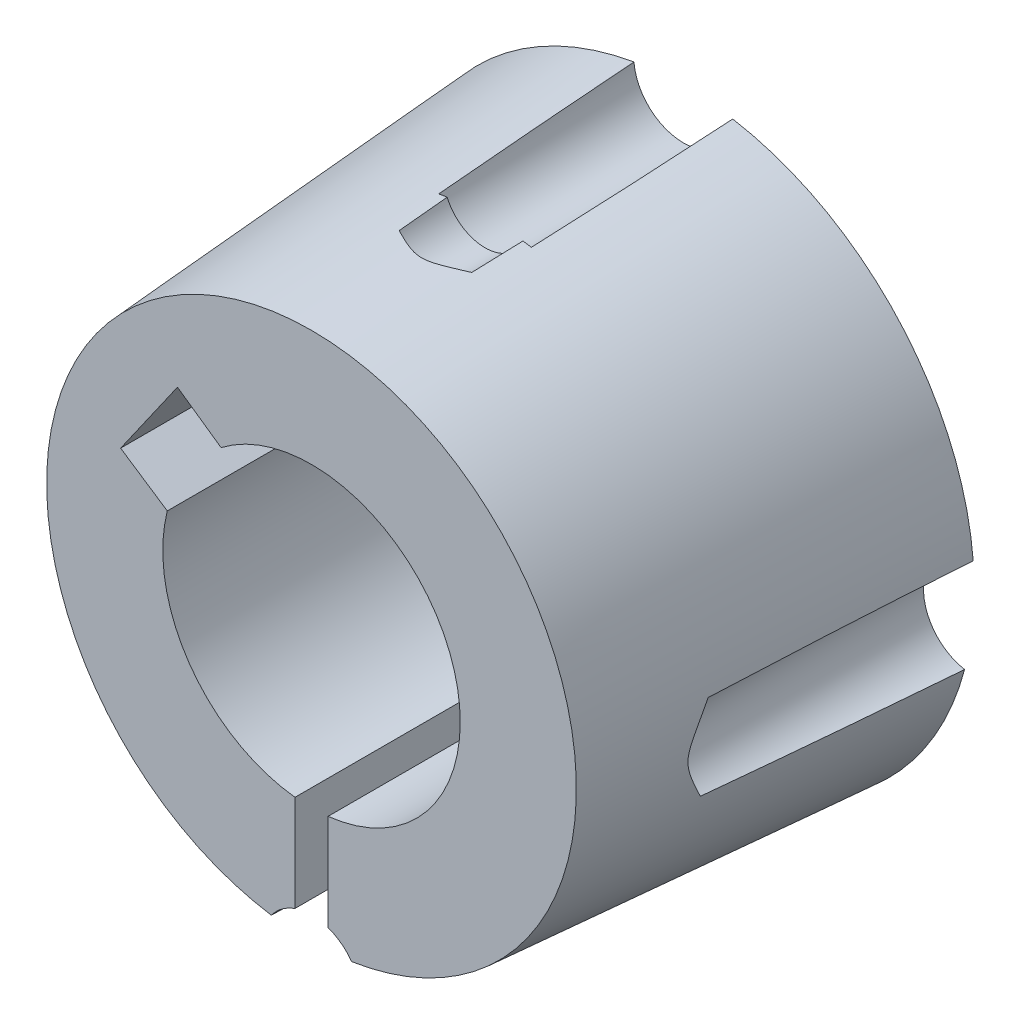
from build123d import *

# Parameters (mm, degrees)
SKETCH1_R                       = 50
EXTRUDE1_DEPTH                  = 22.5
F_6_0_6_DIAMETER_HOLE2_D        = 6
F_6_0_6_DIAMETER_HOLE2_DEPTH    = 15
F_6_0_6_DIAMETER_HOLE2_TIP      = 1.802581857
SKETCH4_R                       = 50
SKETCH4_R_2                     = 17.6
CUT_EXTRUDE1_DEPTH              = 75.204110398
CUT_EXTRUDE1_DRAFT              = 4
SKETCH6_R                       = 9
CUT_EXTRUDE2_DEPTH              = 34.520451954
SKETCH11_W                      = 2
SKETCH11_H                      = 100
CUT_EXTRUDE3_DEPTH              = 34.520451954
SKETCH12_R                      = 3
CUT_EXTRUDE4_DEPTH              = 34.520451954
M6X1_0_TAPPED_HOLE2_D           = 5
M6X1_0_TAPPED_HOLE2_DEPTH       = 15
M6X1_0_TAPPED_HOLE2_CBORE_D     = 6
M6X1_0_TAPPED_HOLE2_CBORE_DEPTH = 12
M6X1_0_TAPPED_HOLE2_TIP         = 1.502151548
CUT_EXTRUDE5_DEPTH              = 34.386914688
CUT_EXTRUDE6_DEPTH              = 0.5


with BuildPart() as part:
    # Sketch1 → Extrude1 (new body)
    with BuildSketch(Plane.XY):
        with Locations(Location((0, 0, 0), (0, 0, 180))):
            Circle(SKETCH1_R)
    extrude(amount=EXTRUDE1_DEPTH)

    # Ø6.0 (6) Diameter Hole2
    with Locations(Plane(origin=(17.533026686, -1.533941072, 0), x_dir=(-1, 0, 0), z_dir=(0, 0, -1))):
        with Locations((0, 0), (35.066053372, 0)):
            Hole(F_6_0_6_DIAMETER_HOLE2_D / 2, depth=F_6_0_6_DIAMETER_HOLE2_DEPTH)
            with Locations((0, 0, -(F_6_0_6_DIAMETER_HOLE2_DEPTH + F_6_0_6_DIAMETER_HOLE2_TIP / 2))):  # 118° drill point
                Cone(0, F_6_0_6_DIAMETER_HOLE2_D / 2, F_6_0_6_DIAMETER_HOLE2_TIP, mode=Mode.SUBTRACT)


with BuildPart() as cut_extrude1_tool:
    # Sketch4 → Cut-Extrude1 (with draft: the straight prism first)
    with BuildSketch(Plane(origin=(0, 0, 0), x_dir=(-1, 0, 0), z_dir=(0, 0, -1))):
        Circle(SKETCH4_R)
        Circle(SKETCH4_R_2, mode=Mode.SUBTRACT)
    extrude(amount=-CUT_EXTRUDE1_DEPTH)
    # Cut-Extrude1: the draft: its side faces are tilted about the plane it starts from
    cut_extrude1_sides = [cut_extrude1_tool.faces().sort_by_distance(p)[0] for p in [
        (50, 0, 37.602055199),
        (17.6, 0, 37.602055199),
    ]]
    draft(cut_extrude1_sides, Plane(origin=(0, 0, 0), x_dir=(-1, 0, 0), z_dir=(0, 0, -1)), CUT_EXTRUDE1_DRAFT)


with BuildPart() as part_1:
    add(part.part)

    # Cut-Extrude1: cut by cut_extrude1_tool
    add(cut_extrude1_tool.part, mode=Mode.SUBTRACT)

    # Sketch6 → Cut-Extrude2 (cut, through all)
    with BuildSketch(Plane(origin=(0, 0, 0), x_dir=(-1, 0, 0), z_dir=(0, 0, -1))):
        Circle(SKETCH6_R)
    extrude(amount=-CUT_EXTRUDE2_DEPTH, mode=Mode.SUBTRACT)

    # Sketch11 → Cut-Extrude3 (cut, through all)
    with BuildSketch(Plane(origin=(0, 0, 0), x_dir=(-1, 0, 0), z_dir=(0, 0, -1))):
        with Locations((0, -54)):
            Rectangle(SKETCH11_W, SKETCH11_H)
    extrude(amount=-CUT_EXTRUDE3_DEPTH, mode=Mode.SUBTRACT)

    # Sketch12 → Cut-Extrude4 (cut, through all)
    with BuildSketch(Plane.XY):
        with Locations((0, -17.6)):
            Circle(SKETCH12_R)
    extrude(amount=CUT_EXTRUDE4_DEPTH, mode=Mode.SUBTRACT)

    # M6x1.0 Tapped Hole2
    with Locations(Plane(origin=(0, 0, 0), x_dir=(-1, 0, 0), z_dir=(0, 0, -1))):
        with Locations((0, 17.6)):
            CounterBoreHole(M6X1_0_TAPPED_HOLE2_D / 2, M6X1_0_TAPPED_HOLE2_CBORE_D / 2, M6X1_0_TAPPED_HOLE2_CBORE_DEPTH, depth=M6X1_0_TAPPED_HOLE2_DEPTH)
            with Locations((0, 0, -(M6X1_0_TAPPED_HOLE2_DEPTH + M6X1_0_TAPPED_HOLE2_TIP / 2))):  # 118° drill point
                Cone(0, M6X1_0_TAPPED_HOLE2_D / 2, M6X1_0_TAPPED_HOLE2_TIP, mode=Mode.SUBTRACT)

    # Sketch18 → Cut-Extrude5 (cut, through all)
    with BuildSketch(Plane(origin=(0, 0, 0), x_dir=(-1, 0, 0), z_dir=(0, 0, -1))):
        Polygon((8.11084141, 8.990863372), (11.550562357, 4.074734834), (2.554311965, -1.904488745), (-0.736786804, 2.795687402), align=None)
    extrude(amount=-CUT_EXTRUDE5_DEPTH, mode=Mode.SUBTRACT)

    # Sketch19 → Cut-Extrude6 (cut)
    # profile 1 of 10: a face of its own
    with BuildSketch(Plane(origin=(0, 0, 0), x_dir=(-1, 0, 0), z_dir=(0, 0, -1))):
        Polygon((-6.01507707, 13.968245292), (-5.743815551, 14.076686297), (-5.398457979, 13.212974358), (-5.177441853, 13.819099158), (-4.837490431, 13.954888921), (-5.09507757, 13.250181389), (-4.348392875, 12.896237579), (-4.685482218, 12.761401842), (-5.343442454, 13.075912559), (-5.144368937, 12.577910756), (-5.415630455, 12.469469751), align=None)
    # profile 2 of 10: a face of its own
    with BuildSketch(Plane(origin=(0, 0, 0), x_dir=(-1, 0, 0), z_dir=(0, 0, -1))):
        with BuildLine():
            Line((-6.078039909, 13.192163481), (-6.233864227, 12.9619251))
            add(Edge.make_bspline(
                [(-6.233864227, 12.9619251), (-6.248946143, 12.966848248), (-6.27784851, 12.976282769), (-6.320838057, 12.985793765), (-6.361278198, 12.989885031), (-6.399724181, 12.989856015), (-6.437177789, 12.984442746), (-6.474869085, 12.974574494), (-6.513853227, 12.961181151), (-6.539172828, 12.948651003), (-6.55219105, 12.942208553)],
                knots=[0, 0, 0, 0, 1.154782209, 2.212977454, 3.198323303, 4.109115155, 5.005269035, 5.945001516, 6.943410408, 8, 8, 8, 8], degree=3))
            add(Edge.make_bspline(
                [(-6.55219105, 12.942208553), (-6.563958672, 12.935819324), (-6.586944135, 12.923339368), (-6.618924133, 12.901917763), (-6.647710423, 12.878657357), (-6.673338853, 12.853455393), (-6.695681333, 12.826183535), (-6.715223043, 12.797353546), (-6.731139602, 12.766401177), (-6.744213656, 12.734194299), (-6.753619605, 12.700899561), (-6.759891402, 12.667267843), (-6.762003912, 12.63354707), (-6.760712484, 12.599668346), (-6.755952611, 12.565777113), (-6.747559619, 12.53168274), (-6.735479808, 12.497602131), (-6.724865718, 12.475493483), (-6.719463687, 12.464241306)],
                knots=[0, 0, 0, 0, 1.129656753, 2.206536146, 3.243275769, 4.249138173, 5.23425726, 6.214366924, 7.182728485, 8.166221291, 9.143181902, 10.097808322, 11.048191284, 11.98824369, 12.954867981, 13.931295931, 14.947134859, 16, 16, 16, 16], degree=3))
            add(Edge.make_bspline(
                [(-6.719463687, 12.464241306), (-6.713609421, 12.453528046), (-6.702196679, 12.432642819), (-6.682167815, 12.40368607), (-6.660378201, 12.377553033), (-6.636320239, 12.354623223), (-6.610701465, 12.334270991), (-6.582982975, 12.317034089), (-6.553080028, 12.303113916), (-6.521746047, 12.291636982), (-6.489269067, 12.283304252), (-6.45607558, 12.279008547), (-6.422618026, 12.277482811), (-6.388759248, 12.280328486), (-6.354559846, 12.285974388), (-6.319944238, 12.295335099), (-6.285087612, 12.308362781), (-6.262297722, 12.319363983), (-6.250718695, 12.324953445)],
                knots=[0, 0, 0, 0, 1.065470632, 2.077107925, 3.069116516, 4.03148788, 4.974068206, 5.921906282, 6.874253604, 7.849361619, 8.832694848, 9.794888128, 10.767532634, 11.751519169, 12.755888645, 13.791011223, 14.877662763, 16, 16, 16, 16], degree=3))
            add(Edge.make_bspline(
                [(-6.250718695, 12.324953445), (-6.236773353, 12.332525923), (-6.209508406, 12.347331097), (-6.172202851, 12.373680364), (-6.138832908, 12.402124287), (-6.110418646, 12.433669667), (-6.085935614, 12.467265969), (-6.065805454, 12.503422115), (-6.049901626, 12.542159142), (-6.043245964, 12.569396943), (-6.039878851, 12.583176602)],
                knots=[0, 0, 0, 0, 1.10234917, 2.155235217, 3.168779213, 4.144345909, 5.099548559, 6.052958628, 7.014987782, 8, 8, 8, 8], degree=3))
            Line((-6.039878851, 12.583176602), (-5.762893174, 12.547877624))
            add(Edge.make_bspline(
                [(-5.762893174, 12.547877624), (-5.768212112, 12.523323942), (-5.778714473, 12.474842158), (-5.805034049, 12.405843632), (-5.838540459, 12.341219123), (-5.880330531, 12.281448941), (-5.929582499, 12.22608886), (-5.986837174, 12.175631651), (-6.051634253, 12.129513802), (-6.099160674, 12.10356181), (-6.123515169, 12.09026294)],
                knots=[0, 0, 0, 0, 0.99565028, 1.965933345, 2.919749403, 3.877664889, 4.851841912, 5.852914449, 6.899744993, 8, 8, 8, 8], degree=3))
            add(Edge.make_bspline(
                [(-6.123515169, 12.09026294), (-6.145930727, 12.079404457), (-6.189724957, 12.058189775), (-6.25669809, 12.033190575), (-6.322782911, 12.01573828), (-6.387582262, 12.004472945), (-6.451378046, 12.001115338), (-6.514085469, 12.004150352), (-6.57577623, 12.014362408), (-6.635670352, 12.031674455), (-6.692809424, 12.054504195), (-6.746540352, 12.081654117), (-6.79652376, 12.112732468), (-6.842007571, 12.148821208), (-6.884441244, 12.188063674), (-6.922017383, 12.232511479), (-6.955931935, 12.280835635), (-6.975036079, 12.315644402), (-6.984683038, 12.333221674)],
                knots=[0, 0, 0, 0, 1.192062078, 2.32898237, 3.415985227, 4.460587547, 5.472080669, 6.468100463, 7.460973309, 8.4585564, 9.447165626, 10.402706733, 11.337688839, 12.259534645, 13.178680223, 14.100176705, 15.04065229, 16, 16, 16, 16], degree=3))
            add(Edge.make_bspline(
                [(-6.984683038, 12.333221674), (-6.990781383, 12.345762605), (-7.002915703, 12.370716204), (-7.018119909, 12.409181941), (-7.030558273, 12.448197309), (-7.04042684, 12.487479646), (-7.047566213, 12.527316845), (-7.051530296, 12.567614301), (-7.053238623, 12.608396859), (-7.051940395, 12.649418426), (-7.047766668, 12.69030624), (-7.041086439, 12.730664971), (-7.031999545, 12.770405041), (-7.019358231, 12.80917343), (-7.004497316, 12.8473478), (-6.986887209, 12.884757987), (-6.966588334, 12.921375458), (-6.943182198, 12.956822602), (-6.918047639, 12.991581386), (-6.889937295, 13.024196516), (-6.859915466, 13.055117735), (-6.828016436, 13.084624967), (-6.793713141, 13.112117378), (-6.757351838, 13.138009994), (-6.718748492, 13.161940091), (-6.691774687, 13.176306187), (-6.678122541, 13.183577243)],
                knots=[0, 0, 0, 0, 0.994456696, 1.978742611, 2.947218028, 3.913684157, 4.865936556, 5.831248412, 6.799841892, 7.775727418, 8.756084613, 9.729418263, 10.692328363, 11.66080378, 12.635282201, 13.612836033, 14.607982406, 15.618861492, 16.641213509, 17.665576822, 18.686921706, 19.714378054, 20.76301221, 21.820442147, 22.89686895, 24, 24, 24, 24], degree=3))
            add(Edge.make_bspline(
                [(-6.678122541, 13.183577243), (-6.652607554, 13.195719091), (-6.602613003, 13.21951006), (-6.524748712, 13.244614308), (-6.446958027, 13.260304864), (-6.382017191, 13.264521858), (-6.330790709, 13.263893348), (-6.292995378, 13.260547854), (-6.25568272, 13.255253723), (-6.218944046, 13.247277994), (-6.182763458, 13.236977173), (-6.147104967, 13.224664865), (-6.11207683, 13.209697152), (-6.089420971, 13.198026285), (-6.078039909, 13.192163481)],
                knots=[0, 0, 0, 0, 1.625700374, 3.185428343, 4.697399225, 6.184334203, 6.9230378, 7.645909924, 8.36759553, 9.091935207, 9.808829122, 10.532757154, 11.262937548, 12, 12, 12, 12], degree=3))
        make_face()
    # profile 3 of 10: a face of its own
    with BuildSketch(Plane(origin=(0, 0, 0), x_dir=(-1, 0, 0), z_dir=(0, 0, -1))):
        with BuildLine():
            add(Edge.make_bspline(
                [(-8.050471806, 12.401832363), (-8.038801149, 12.409099553), (-8.015576009, 12.423561591), (-7.979249749, 12.442203225), (-7.942154344, 12.458454194), (-7.904364449, 12.472675374), (-7.865345164, 12.483568533), (-7.825613034, 12.492754609), (-7.784845932, 12.498516451), (-7.74357131, 12.502438454), (-7.702244961, 12.503785873), (-7.661245039, 12.502094645), (-7.620984659, 12.49801448), (-7.581221629, 12.491343225), (-7.54224515, 12.481787579), (-7.503918589, 12.469614869), (-7.466236088, 12.455020315), (-7.429562467, 12.437513277), (-7.394014108, 12.417822392), (-7.35995452, 12.396261648), (-7.327655952, 12.372574533), (-7.297151271, 12.346979633), (-7.268782007, 12.318931984), (-7.241714394, 12.28949949), (-7.216352724, 12.257950242), (-7.201328448, 12.235420603), (-7.193756061, 12.224065436)],
                knots=[0, 0, 0, 0, 1.017522182, 2.024915578, 3.019386828, 4.015095984, 5.011176212, 6.016488721, 7.032041747, 8.056621552, 9.085191157, 10.090503666, 11.092410146, 12.079421358, 13.073025156, 14.060878435, 15.054823108, 16.062338776, 17.067007786, 18.061974384, 19.044607752, 20.030370136, 21.007125348, 21.995913416, 22.989920054, 24, 24, 24, 24], degree=3))
            add(Edge.make_bspline(
                [(-7.193756061, 12.224065436), (-7.186529212, 12.212373043), (-7.172170939, 12.189142647), (-7.152951822, 12.153178535), (-7.136725849, 12.116128339), (-7.123126803, 12.078142923), (-7.111483713, 12.039472459), (-7.103102495, 11.999752972), (-7.096520042, 11.959456075), (-7.093191189, 11.918416626), (-7.092192606, 11.877427155), (-7.093794006, 11.836746027), (-7.097891927, 11.796801481), (-7.104580301, 11.757362693), (-7.114085214, 11.718547155), (-7.126627616, 11.680515485), (-7.141254436, 11.642925041), (-7.158719485, 11.606340578), (-7.178388978, 11.570715983), (-7.200246507, 11.536607742), (-7.224747308, 11.504511896), (-7.250581164, 11.473362051), (-7.279560847, 11.44463601), (-7.309917405, 11.416774564), (-7.342834009, 11.390931155), (-7.366121916, 11.375262791), (-7.377883164, 11.367349691)],
                knots=[0, 0, 0, 0, 1.014071571, 2.014752965, 3.005851775, 3.995499013, 4.990386593, 5.982965668, 6.988525787, 8.001148511, 9.01820181, 10.012289716, 11.003018114, 11.978971459, 12.961608853, 13.94850152, 14.931792377, 15.935891367, 16.937153354, 17.932962839, 18.921589614, 19.915031158, 20.916079282, 21.929396504, 22.954269141, 24, 24, 24, 24], degree=3))
            add(Edge.make_bspline(
                [(-7.377883164, 11.367349691), (-7.395467114, 11.356440184), (-7.430118762, 11.334941466), (-7.485391859, 11.310230382), (-7.541028928, 11.28995911), (-7.598178248, 11.276796792), (-7.656312944, 11.268819226), (-7.715674593, 11.268007852), (-7.776193726, 11.271852813), (-7.836926917, 11.282562716), (-7.896680822, 11.298211311), (-7.953833816, 11.319169195), (-8.007448739, 11.345415539), (-8.057916219, 11.376380885), (-8.104649228, 11.412941315), (-8.148569329, 11.454094651), (-8.188779982, 11.500646651), (-8.212229684, 11.534811649), (-8.224104618, 11.552112812)],
                knots=[0, 0, 0, 0, 1.029578441, 2.028929159, 3.009184395, 3.974812519, 4.944071378, 5.92635788, 6.926614785, 7.960421992, 8.992650506, 9.999947698, 10.986990515, 11.961384063, 12.94357123, 13.937116802, 14.955355494, 16, 16, 16, 16], degree=3))
            add(Edge.make_bspline(
                [(-8.224104618, 11.552112812), (-8.23587008, 11.571279998), (-8.258985633, 11.608937686), (-8.285969684, 11.668691807), (-8.306552859, 11.729149909), (-8.319998883, 11.790819903), (-8.326691194, 11.853515452), (-8.32665254, 11.917255308), (-8.319786323, 11.982139118), (-8.30969657, 12.024867577), (-8.304560848, 12.046616518)],
                knots=[0, 0, 0, 0, 1.043956669, 2.051057164, 3.038397822, 4.006289408, 4.97704575, 5.961976278, 6.96263855, 8, 8, 8, 8], degree=3))
            add(Edge.make_bspline(
                [(-8.304560848, 12.046616518), (-8.299043229, 12.065376257), (-8.288196786, 12.102253837), (-8.266745706, 12.155150141), (-8.2407845, 12.204471847), (-8.211326035, 12.250997343), (-8.176954578, 12.293623764), (-8.138951969, 12.333292714), (-8.096877352, 12.369860116), (-8.066057571, 12.391094165), (-8.050471806, 12.401832363)],
                knots=[0, 0, 0, 0, 1.049312755, 2.06272143, 3.057944532, 4.038217785, 5.014037749, 5.992045503, 6.984564234, 8, 8, 8, 8], degree=3))
        make_face()
        with BuildLine():
            add(Edge.make_bspline(
                [(-7.895919522, 12.171593982), (-7.905180456, 12.165319148), (-7.923406448, 12.152969953), (-7.947847581, 12.131442404), (-7.969749991, 12.108486293), (-7.988556514, 12.083573768), (-8.004456028, 12.056949413), (-8.018124845, 12.028897094), (-8.028083857, 11.998665166), (-8.035778605, 11.967212243), (-8.040124846, 11.934919082), (-8.041557823, 11.902534688), (-8.039221109, 11.870351013), (-8.033733666, 11.838315484), (-8.025229837, 11.806390041), (-8.012843752, 11.774802173), (-7.997717927, 11.743207921), (-7.98525736, 11.722990164), (-7.978919823, 11.712707263)],
                knots=[0, 0, 0, 0, 1.027953042, 2.023064323, 2.98860306, 3.942105833, 4.886795451, 5.83745291, 6.805547806, 7.80817665, 8.811942476, 9.797407398, 10.784462519, 11.773393669, 12.783248845, 13.817102823, 14.88976229, 16, 16, 16, 16], degree=3))
            add(Edge.make_bspline(
                [(-7.978919823, 11.712707263), (-7.971868405, 11.702415075), (-7.958048142, 11.682243139), (-7.935088605, 11.65456853), (-7.910891825, 11.629785479), (-7.884936835, 11.608488387), (-7.857911007, 11.589874662), (-7.829446622, 11.574513441), (-7.79956418, 11.562356063), (-7.768663235, 11.553255179), (-7.73715398, 11.547064746), (-7.705691889, 11.544645689), (-7.674553156, 11.545116322), (-7.643867773, 11.549405665), (-7.613502786, 11.556746759), (-7.583574893, 11.56729887), (-7.553906403, 11.581064571), (-7.535082709, 11.592621459), (-7.525439254, 11.598542099)],
                knots=[0, 0, 0, 0, 1.140652444, 2.23559534, 3.284584497, 4.303800959, 5.301530346, 6.281961152, 7.256042948, 8.246965043, 9.224370784, 10.187387521, 11.12808357, 12.067379474, 13.015094811, 13.981035694, 14.96567643, 16, 16, 16, 16], degree=3))
            add(Edge.make_bspline(
                [(-7.525439254, 11.598542099), (-7.51606817, 11.604919732), (-7.497743808, 11.617390655), (-7.473193961, 11.639111945), (-7.450873583, 11.661977191), (-7.431944967, 11.687082526), (-7.415830347, 11.713874813), (-7.402447052, 11.742192445), (-7.39189369, 11.77234801), (-7.384303367, 11.803990672), (-7.379965037, 11.836487549), (-7.37851088, 11.869089022), (-7.380939238, 11.901572525), (-7.386226179, 11.933994375), (-7.395212931, 11.966292376), (-7.407866624, 11.998208007), (-7.423407582, 12.030171411), (-7.436007497, 12.050743949), (-7.442438953, 12.061244923)],
                knots=[0, 0, 0, 0, 1.032259969, 2.018497109, 2.982085526, 3.94062233, 4.876887455, 5.827796524, 6.790415535, 7.784103199, 8.788491308, 9.77482311, 10.753075933, 11.752244954, 12.764964536, 13.802097087, 14.878110118, 16, 16, 16, 16], degree=3))
            add(Edge.make_bspline(
                [(-7.442438953, 12.061244923), (-7.449364863, 12.071446673), (-7.462889137, 12.091367706), (-7.48574, 12.118447728), (-7.5095095, 12.142893457), (-7.535189836, 12.163976288), (-7.56213046, 12.182098138), (-7.590470782, 12.197221445), (-7.620144005, 12.209467923), (-7.651166028, 12.218061248), (-7.682605658, 12.224337528), (-7.714084999, 12.22687844), (-7.74531366, 12.225842527), (-7.776113219, 12.221735639), (-7.806737503, 12.214361751), (-7.836901366, 12.20337526), (-7.867077123, 12.189478815), (-7.886177412, 12.17763495), (-7.895919522, 12.171593982)],
                knots=[0, 0, 0, 0, 1.128977829, 2.204563323, 3.241530307, 4.248737579, 5.242653714, 6.211534756, 7.187206196, 8.177033494, 9.156034304, 10.120622629, 11.063104053, 12.013557549, 12.962819502, 13.94273511, 14.950691235, 16, 16, 16, 16], degree=3))
        make_face(mode=Mode.SUBTRACT)
    # profile 4 of 10: a face of its own
    with BuildSketch(Plane(origin=(0, 0, 0), x_dir=(-1, 0, 0), z_dir=(0, 0, -1))):
        Polygon((-9.578253361, 11.764940887), (-9.341654803, 11.950022017), (-8.547268786, 10.933029829), (-8.202547231, 11.202065286), (-8.026370348, 10.976597037), (-8.607690461, 10.52248045), align=None)
    # profile 5 of 10: a face of its own
    with BuildSketch(Plane(origin=(0, 0, 0), x_dir=(-1, 0, 0), z_dir=(0, 0, -1))):
        Polygon((-10.230374439, 10.009356107), (-9.841767668, 10.390966684), (-9.65096238, 10.196663298), (-10.03956915, 9.815052721), align=None)
    # profile 6 of 10: a face of its own
    with BuildSketch(Plane(origin=(0, 0, 0), x_dir=(-1, 0, 0), z_dir=(0, 0, -1))):
        with BuildLine():
            Line((-11.569946309, 9.166281787), (-11.410623894, 9.359313137))
            Line((-11.410623894, 9.359313137), (-11.297730765, 9.266136554))
            add(Edge.make_bspline(
                [(-11.297730765, 9.266136554), (-11.30393648, 9.280200273), (-11.31604535, 9.307642028), (-11.32746083, 9.350050526), (-11.332789437, 9.391808257), (-11.331758199, 9.432507825), (-11.32527506, 9.471931223), (-11.31241504, 9.508955519), (-11.295586029, 9.544392217), (-11.279683012, 9.565102906), (-11.271654042, 9.575559131)],
                knots=[0, 0, 0, 0, 1.121227326, 2.187788776, 3.193991257, 4.185073742, 5.150957556, 6.098269464, 7.039871565, 8, 8, 8, 8], degree=3))
            add(Edge.make_bspline(
                [(-11.271654042, 9.575559131), (-11.265255292, 9.582731461), (-11.252233854, 9.597327135), (-11.228902949, 9.61640161), (-11.202384654, 9.633758089), (-11.182838272, 9.643195764), (-11.172753301, 9.64806514)],
                knots=[0, 0, 0, 0, 0.931520373, 1.89564149, 2.914254528, 4, 4, 4, 4], degree=3))
            Line((-11.172753301, 9.64806514), (-11.036645528, 9.417826759))
            add(Edge.make_bspline(
                [(-11.036645528, 9.417826759), (-11.04475746, 9.414013851), (-11.059963834, 9.406866294), (-11.080579891, 9.395163265), (-11.09744047, 9.382928299), (-11.106300708, 9.373539996), (-11.110423573, 9.36917141)],
                knots=[0, 0, 0, 0, 1.207448222, 2.263444732, 3.19194227, 4, 4, 4, 4], degree=3))
            add(Edge.make_bspline(
                [(-11.110423573, 9.36917141), (-11.113771317, 9.364717941), (-11.120374816, 9.355933376), (-11.127366664, 9.340876608), (-11.132214939, 9.324941948), (-11.134437465, 9.307752959), (-11.133910409, 9.289484643), (-11.131407278, 9.269941163), (-11.12607962, 9.249361472), (-11.118857732, 9.227184337), (-11.107311485, 9.203582935), (-11.09123978, 9.178188614), (-11.070269918, 9.150838015), (-11.044784815, 9.121328686), (-11.014453661, 9.08977237), (-10.978967484, 9.056649276), (-10.939227429, 9.020874802), (-10.910684652, 8.996906868), (-10.895767624, 8.984380745)],
                knots=[0, 0, 0, 0, 0.554204912, 1.093181219, 1.644961598, 2.210047032, 2.812640863, 3.46294414, 4.170515869, 4.92929097, 5.785019909, 6.782210114, 7.921684982, 9.218376952, 10.668690913, 12.28375307, 14.057814751, 16, 16, 16, 16], degree=3))
            Line((-10.895767624, 8.984380745), (-10.850928381, 8.949081767))
            Line((-10.850928381, 8.949081767), (-10.488080324, 8.650153482))
            Line((-10.488080324, 8.650153482), (-10.672525436, 8.426593285))
            Line((-10.672525436, 8.426593285), (-11.569946309, 9.166281787))
        make_face()
    # profile 7 of 10: a face of its own
    with BuildSketch(Plane(origin=(0, 0, 0), x_dir=(-1, 0, 0), z_dir=(0, 0, -1))):
        with BuildLine():
            Line((-11.184667723, 8.571238001), (-11.72178461, 7.804200741))
            add(Edge.make_bspline(
                [(-11.72178461, 7.804200741), (-11.712420987, 7.799895203), (-11.694098162, 7.791470086), (-11.665738174, 7.781901398), (-11.637541207, 7.774949664), (-11.609472029, 7.770322002), (-11.581449213, 7.768817877), (-11.553559857, 7.769727902), (-11.525684999, 7.773313488), (-11.498045293, 7.779224219), (-11.471016234, 7.788192378), (-11.444926792, 7.799764143), (-11.419511679, 7.813388105), (-11.395389434, 7.830124302), (-11.372073354, 7.849143625), (-11.350140787, 7.871129875), (-11.328668261, 7.895097927), (-11.315850491, 7.912836407), (-11.309327178, 7.921864002)],
                knots=[0, 0, 0, 0, 1.049329495, 2.053337698, 3.043368579, 4.005623484, 4.946678857, 5.897534907, 6.844519803, 7.806168563, 8.772595506, 9.739685893, 10.71098758, 11.705425802, 12.725851281, 13.772008655, 14.866114553, 16, 16, 16, 16], degree=3))
            add(Edge.make_bspline(
                [(-11.309327178, 7.921864002), (-11.301901212, 7.933074123), (-11.287297368, 7.955119856), (-11.26939122, 7.990079718), (-11.255407178, 8.025918728), (-11.244640137, 8.062570316), (-11.238479334, 8.100279774), (-11.235647192, 8.138682271), (-11.235975929, 8.178028462), (-11.239700268, 8.20428198), (-11.241591301, 8.217612199)],
                knots=[0, 0, 0, 0, 1.035754429, 2.036906193, 3.019994674, 3.997431806, 4.975210304, 5.958332731, 6.963343795, 8, 8, 8, 8], degree=3))
            Line((-11.241591301, 8.217612199), (-11.006582787, 8.352447937))
            add(Edge.make_bspline(
                [(-11.006582787, 8.352447937), (-10.998531211, 8.327916864), (-10.982753564, 8.279846452), (-10.970195864, 8.206013978), (-10.966762889, 8.133344709), (-10.973295305, 8.06147942), (-10.989393653, 7.989896459), (-11.016107591, 7.918519593), (-11.051686124, 7.846261189), (-11.082347376, 7.800477485), (-11.098169326, 7.776851983)],
                knots=[0, 0, 0, 0, 1.017267573, 1.993409463, 2.943492483, 3.879672184, 4.831180299, 5.828583672, 6.879496518, 8, 8, 8, 8], degree=3))
            add(Edge.make_bspline(
                [(-11.098169326, 7.776851983), (-11.111294906, 7.758878439), (-11.137041219, 7.723622667), (-11.180741425, 7.676245858), (-11.226367183, 7.634033719), (-11.274940133, 7.597660377), (-11.326057462, 7.56706891), (-11.380003819, 7.542509136), (-11.436295431, 7.523168583), (-11.494770133, 7.510163712), (-11.554054236, 7.502270687), (-11.613111875, 7.501156507), (-11.671255799, 7.505605122), (-11.728587643, 7.515635783), (-11.784814735, 7.532575296), (-11.840349847, 7.554853546), (-11.895128571, 7.583273152), (-11.929860893, 7.60638227), (-11.947570868, 7.618165585)],
                knots=[0, 0, 0, 0, 1.102148284, 2.161904748, 3.188097774, 4.178853996, 5.163561427, 6.134382747, 7.111197591, 8.10777208, 9.098180069, 10.070251313, 11.029160263, 11.984392872, 12.948468085, 13.933721848, 14.946406938, 16, 16, 16, 16], degree=3))
            add(Edge.make_bspline(
                [(-11.947570868, 7.618165585), (-11.965126059, 7.630968298), (-11.99954676, 7.656070751), (-12.045638377, 7.698935227), (-12.087190648, 7.743757067), (-12.122790749, 7.791982653), (-12.153201738, 7.842759287), (-12.178278228, 7.896309818), (-12.197591567, 7.952745442), (-12.211483726, 8.011325933), (-12.219811007, 8.070749365), (-12.221952413, 8.12997203), (-12.218734735, 8.188312479), (-12.208581539, 8.245727789), (-12.192742152, 8.302151427), (-12.170397122, 8.357527631), (-12.142535126, 8.412206696), (-12.119544319, 8.446791411), (-12.107847311, 8.464387039)],
                knots=[0, 0, 0, 0, 1.081770808, 2.121042698, 3.130463928, 4.12348657, 5.10180492, 6.075363543, 7.06423347, 8.068653521, 9.071113429, 10.048975394, 11.017318833, 11.976863704, 12.948356844, 13.932135301, 14.947934742, 16, 16, 16, 16], degree=3))
            add(Edge.make_bspline(
                [(-12.107847311, 8.464387039), (-12.094570545, 8.482320741), (-12.068517819, 8.517511677), (-12.025171891, 8.565422979), (-11.978838534, 8.607271375), (-11.929990795, 8.643464263), (-11.878450261, 8.673925295), (-11.82421801, 8.698581317), (-11.767166051, 8.716923246), (-11.708202702, 8.729987397), (-11.647892286, 8.737108061), (-11.587218633, 8.737332865), (-11.526686065, 8.731236993), (-11.466376916, 8.718745967), (-11.406329131, 8.699804845), (-11.346586999, 8.674502863), (-11.287152649, 8.642532561), (-11.249021136, 8.61703932), (-11.229506966, 8.603992908)],
                knots=[0, 0, 0, 0, 1.069938341, 2.099518151, 3.093186277, 4.060375731, 5.010954283, 5.959940222, 6.911905033, 7.880416925, 8.853018278, 9.819177917, 10.785083277, 11.766392257, 12.768339852, 13.800603378, 14.874437571, 16, 16, 16, 16], degree=3))
            Line((-11.229506966, 8.603992908), (-11.184667723, 8.571238001))
        make_face()
        with BuildLine():
            add(Edge.make_bspline(
                [(-11.540201577, 8.463433013), (-11.556200728, 8.467921504), (-11.587887761, 8.476811162), (-11.637302793, 8.480140366), (-11.686756001, 8.474707845), (-11.735696842, 8.461763545), (-11.782844095, 8.441187141), (-11.826240784, 8.412831308), (-11.865327261, 8.377107721), (-11.886930477, 8.348784046), (-11.897961493, 8.334321434)],
                knots=[0, 0, 0, 0, 0.975971153, 1.93295441, 2.892679018, 3.89293378, 4.901384709, 5.906743291, 6.931142957, 8, 8, 8, 8], degree=3))
            add(Edge.make_bspline(
                [(-11.897961493, 8.334321434), (-11.908605763, 8.317772847), (-11.92953756, 8.2852303), (-11.950674695, 8.231781656), (-11.963615838, 8.176480115), (-11.964153952, 8.138923957), (-11.964425335, 8.119983493)],
                knots=[0, 0, 0, 0, 1.032393449, 2.030186181, 3.006576045, 4, 4, 4, 4], degree=3))
            add(Edge.make_bspline(
                [(-11.964425335, 8.119983493), (-11.963374731, 8.107396229), (-11.961118154, 8.080360263), (-11.947876519, 8.0387467), (-11.928698344, 7.993144015), (-11.911550528, 7.962616649), (-11.902413617, 7.946350681)],
                knots=[0, 0, 0, 0, 0.812208648, 1.744528858, 2.798212002, 4, 4, 4, 4], degree=3))
            Line((-11.902413617, 7.946350681), (-11.540201577, 8.463433013))
        make_face(mode=Mode.SUBTRACT)
    # profile 8 of 10: a face of its own
    with BuildSketch(Plane(origin=(0, 0, 0), x_dir=(-1, 0, 0), z_dir=(0, 0, -1))):
        with BuildLine():
            Line((-13.033926904, 6.895134075), (-12.921987802, 6.833122356))
            add(Edge.make_bspline(
                [(-12.921987802, 6.833122356), (-12.926572308, 6.850858933), (-12.935556835, 6.885618349), (-12.942963439, 6.938162325), (-12.946171938, 6.989564868), (-12.943530417, 7.040099616), (-12.935776631, 7.089596993), (-12.923496682, 7.138186221), (-12.905513234, 7.18569951), (-12.889857468, 7.215936645), (-12.881918691, 7.231269392)],
                knots=[0, 0, 0, 0, 1.06875102, 2.094494431, 3.092417297, 4.071471351, 5.042137708, 6.013277426, 6.992566162, 8, 8, 8, 8], degree=3))
            add(Edge.make_bspline(
                [(-12.881918691, 7.231269392), (-12.872365262, 7.247264044), (-12.853499586, 7.278849552), (-12.820271494, 7.322166889), (-12.783451753, 7.361038569), (-12.742804903, 7.395274948), (-12.69837543, 7.424909216), (-12.650401198, 7.450124469), (-12.598832663, 7.470882493), (-12.544188666, 7.486863179), (-12.487494895, 7.498177239), (-12.429920846, 7.503131644), (-12.372084886, 7.502516691), (-12.314147076, 7.496093641), (-12.255776555, 7.48389682), (-12.197397289, 7.465638097), (-12.138600259, 7.44169258), (-12.100619308, 7.421566984), (-12.081172497, 7.41126238)],
                knots=[0, 0, 0, 0, 0.975230111, 1.925839815, 2.852705565, 3.774769215, 4.703362953, 5.644668147, 6.608706617, 7.610138812, 8.622836479, 9.631736944, 10.63122781, 11.647844964, 12.680170438, 13.749707247, 14.847816708, 16, 16, 16, 16], degree=3))
            add(Edge.make_bspline(
                [(-12.081172497, 7.41126238), (-12.062846571, 7.400551973), (-12.026829035, 7.379501879), (-11.977096945, 7.343076717), (-11.932302616, 7.303351235), (-11.892002501, 7.260777692), (-11.856746035, 7.214609338), (-11.826578514, 7.165174342), (-11.800878731, 7.112632093), (-11.780494589, 7.057504674), (-11.765433473, 7.001256623), (-11.755173157, 6.945436132), (-11.751522659, 6.890520573), (-11.752944259, 6.836595993), (-11.760314091, 6.783588905), (-11.773435226, 6.731571464), (-11.792247726, 6.680446311), (-11.809025772, 6.647984229), (-11.81754319, 6.631504768)],
                knots=[0, 0, 0, 0, 1.112224673, 2.185951845, 3.225245761, 4.247401687, 5.254399294, 6.264672993, 7.27869959, 8.316119804, 9.34062961, 10.328274067, 11.286429929, 12.220447087, 13.151749072, 14.085782762, 15.028242608, 16, 16, 16, 16], degree=3))
            add(Edge.make_bspline(
                [(-11.81754319, 6.631504768), (-11.825858957, 6.617337635), (-11.842304128, 6.589320865), (-11.871441351, 6.550755557), (-11.903778853, 6.515877039), (-11.93932349, 6.484360063), (-11.979024761, 6.456370368), (-12.023283317, 6.431713568), (-12.072029736, 6.409083382), (-12.107009964, 6.397423784), (-12.125057714, 6.391408114)],
                knots=[0, 0, 0, 0, 0.983536515, 1.945031185, 2.888743951, 3.829095898, 4.785881041, 5.792579928, 6.861100508, 8, 8, 8, 8], degree=3))
            Line((-12.125057714, 6.391408114), (-11.645818431, 6.125870754))
            Line((-11.645818431, 6.125870754), (-11.786378327, 5.872735738))
            Line((-11.786378327, 5.872735738), (-13.1744868, 6.641999059))
            Line((-13.1744868, 6.641999059), (-13.033926904, 6.895134075))
        make_face()
        with BuildLine():
            add(Edge.make_bspline(
                [(-12.676166988, 7.047778306), (-12.681339942, 7.037796116), (-12.691488695, 7.018212185), (-12.70324455, 6.987731214), (-12.712088307, 6.957114629), (-12.71688904, 6.926139436), (-12.719562063, 6.895155393), (-12.717520131, 6.864049193), (-12.713331515, 6.832779122), (-12.705220999, 6.801704503), (-12.694296517, 6.771387719), (-12.680042356, 6.742498956), (-12.66330716, 6.715090256), (-12.643237357, 6.689409858), (-12.620441157, 6.665222103), (-12.59428865, 6.643009466), (-12.565777097, 6.621685621), (-12.544757617, 6.609663219), (-12.534017049, 6.603519993)],
                knots=[0, 0, 0, 0, 1.030875901, 2.022462236, 2.992394869, 3.948575862, 4.894461937, 5.83914714, 6.801982908, 7.785667268, 8.779492972, 9.7538531, 10.736382788, 11.72078813, 12.739014768, 13.780253785, 14.865750409, 16, 16, 16, 16], degree=3))
            add(Edge.make_bspline(
                [(-12.534017049, 6.603519993), (-12.522874792, 6.59760303), (-12.501105282, 6.58604259), (-12.4674689, 6.572273193), (-12.434000292, 6.562148267), (-12.400835819, 6.554935562), (-12.367893332, 6.5515267), (-12.335294322, 6.551071959), (-12.302869266, 6.554296477), (-12.270986163, 6.561100024), (-12.239992842, 6.570367824), (-12.210743551, 6.58299961), (-12.183391122, 6.598145403), (-12.158118308, 6.616296965), (-12.13422195, 6.636508563), (-12.113146682, 6.660472674), (-12.093126732, 6.68635066), (-12.082024672, 6.705462477), (-12.076402365, 6.715141086)],
                knots=[0, 0, 0, 0, 1.145591927, 2.238233667, 3.295286115, 4.318956776, 5.31647513, 6.298770455, 7.276144334, 8.269563791, 9.256521153, 10.209928257, 11.158361792, 12.090870707, 13.033025755, 13.994327401, 14.984286922, 16, 16, 16, 16], degree=3))
            add(Edge.make_bspline(
                [(-12.076402365, 6.715141086), (-12.071292923, 6.724786513), (-12.061200935, 6.743837814), (-12.050315152, 6.773859379), (-12.042201178, 6.803950868), (-12.03729622, 6.834325943), (-12.036170897, 6.865151018), (-12.037951641, 6.896294724), (-12.043560751, 6.927694583), (-12.052161948, 6.958947891), (-12.063359809, 6.989791582), (-12.078228415, 7.019010537), (-12.09531217, 7.046865932), (-12.115575895, 7.072887154), (-12.138930822, 7.096919397), (-12.164722212, 7.119674416), (-12.19354465, 7.140446281), (-12.214311709, 7.15257311), (-12.224912481, 7.158763382)],
                knots=[0, 0, 0, 0, 1.000962133, 1.977064551, 2.923614062, 3.859549046, 4.794572946, 5.750034753, 6.717953315, 7.716547425, 8.723405251, 9.724367384, 10.72082546, 11.71941957, 12.744915865, 13.79310884, 14.873468298, 16, 16, 16, 16], degree=3))
            add(Edge.make_bspline(
                [(-12.224912481, 7.158763382), (-12.235731616, 7.164487025), (-12.256858834, 7.175663948), (-12.289682741, 7.188576525), (-12.322000558, 7.198969576), (-12.354398105, 7.205786377), (-12.386703885, 7.208770009), (-12.418973457, 7.209334903), (-12.451151432, 7.206013294), (-12.482853317, 7.19963189), (-12.513592328, 7.190562654), (-12.542705961, 7.178422559), (-12.569794981, 7.163484341), (-12.594926766, 7.145620585), (-12.618427205, 7.125448241), (-12.639880608, 7.102244602), (-12.659471538, 7.076399962), (-12.670529235, 7.057443324), (-12.676166988, 7.047778306)],
                knots=[0, 0, 0, 0, 1.127851269, 2.202427411, 3.247385766, 4.255768716, 5.247864399, 6.235181198, 7.227276882, 8.224128541, 9.213765257, 10.177724499, 11.12715199, 12.060082331, 13.016428696, 13.977807318, 14.968987629, 16, 16, 16, 16], degree=3))
        make_face(mode=Mode.SUBTRACT)
    # profile 9 of 10: a face of its own
    with BuildSketch(Plane(origin=(0, 0, 0), x_dir=(-1, 0, 0), z_dir=(0, 0, -1))):
        with BuildLine():
            Line((-13.47077545, 5.997237808), (-13.357564313, 6.265001229))
            Line((-13.357564313, 6.265001229), (-12.287146644, 5.812792696))
            Line((-12.287146644, 5.812792696), (-12.400357782, 5.545029274))
            Line((-12.400357782, 5.545029274), (-12.51356892, 5.592730596))
            add(Edge.make_bspline(
                [(-12.51356892, 5.592730596), (-12.507241376, 5.574800893), (-12.494982385, 5.540063864), (-12.481826977, 5.488056729), (-12.474063799, 5.438117041), (-12.471332376, 5.389946029), (-12.474027049, 5.342841926), (-12.481345274, 5.296156305), (-12.493766106, 5.249475332), (-12.505637295, 5.219178673), (-12.511660867, 5.203805817)],
                knots=[0, 0, 0, 0, 1.141836047, 2.212194494, 3.217329301, 4.173924199, 5.105083242, 6.046313845, 7.008678227, 8, 8, 8, 8], degree=3))
            add(Edge.make_bspline(
                [(-12.511660867, 5.203805817), (-12.519374846, 5.186986494), (-12.534612975, 5.153761746), (-12.563253064, 5.107397487), (-12.596033973, 5.064919721), (-12.633372435, 5.026446926), (-12.674739934, 4.991691439), (-12.720644429, 4.960990657), (-12.770791118, 4.934361854), (-12.824352008, 4.911568793), (-12.880399402, 4.893962324), (-12.937499605, 4.881252039), (-12.995185478, 4.875024239), (-13.053233218, 4.874340771), (-13.111695431, 4.879548282), (-13.17070477, 4.89037758), (-13.230054877, 4.907323498), (-13.268849668, 4.922572265), (-13.2885564, 4.930318237)],
                knots=[0, 0, 0, 0, 0.968679645, 1.913521578, 2.847727792, 3.774609384, 4.716754542, 5.673259128, 6.662105352, 7.687379859, 8.718368836, 9.735761957, 10.747058889, 11.752299364, 12.772462431, 13.817062217, 14.891125103, 16, 16, 16, 16], degree=3))
            add(Edge.make_bspline(
                [(-13.2885564, 4.930318237), (-13.308525979, 4.939346018), (-13.347707389, 4.957059022), (-13.40285814, 4.9882267), (-13.453143865, 5.023121565), (-13.498727011, 5.061312479), (-13.539793695, 5.102812595), (-13.575851277, 5.148005314), (-13.60752286, 5.196334156), (-13.633667267, 5.247871701), (-13.654960671, 5.300718504), (-13.670221376, 5.35426721), (-13.680414244, 5.407570872), (-13.684137829, 5.460923471), (-13.682225892, 5.514118297), (-13.674598153, 5.567138258), (-13.660802897, 5.619969275), (-13.647605389, 5.654220701), (-13.640910166, 5.671596782)],
                knots=[0, 0, 0, 0, 1.147500324, 2.251458613, 3.312659526, 4.349156263, 5.362112156, 6.365374176, 7.372546368, 8.383201903, 9.387431382, 10.352206096, 11.295279913, 12.224904426, 13.147187779, 14.078452354, 15.025180246, 16, 16, 16, 16], degree=3))
            add(Edge.make_bspline(
                [(-13.640910166, 5.671596782), (-13.633811902, 5.687238008), (-13.619728781, 5.718270565), (-13.593146999, 5.761500779), (-13.56266031, 5.80124821), (-13.528431847, 5.837763066), (-13.490292566, 5.870827193), (-13.448095802, 5.900230648), (-13.40237789, 5.926598221), (-13.369493808, 5.940545528), (-13.35279418, 5.947628433)],
                knots=[0, 0, 0, 0, 1.004608065, 1.99316578, 2.962374379, 3.932456425, 4.917717995, 5.910937828, 6.939104951, 8, 8, 8, 8], degree=3))
            Line((-13.35279418, 5.947628433), (-13.47077545, 5.997237808))
        make_face()
        with BuildLine():
            add(Edge.make_bspline(
                [(-13.369648648, 5.621987407), (-13.373664583, 5.611666999), (-13.381543401, 5.591419508), (-13.38978887, 5.560293842), (-13.395013478, 5.529429847), (-13.396667687, 5.498477943), (-13.394565241, 5.46781333), (-13.389920645, 5.437176942), (-13.381502631, 5.406802917), (-13.369772454, 5.376926559), (-13.355287178, 5.347931761), (-13.337606833, 5.320973888), (-13.317859528, 5.295519543), (-13.295105951, 5.272206668), (-13.269582857, 5.251032665), (-13.241709281, 5.23140815), (-13.211125611, 5.213893151), (-13.189319482, 5.204051084), (-13.178207341, 5.199035684)],
                knots=[0, 0, 0, 0, 1.021838077, 2.004732304, 2.966942074, 3.907809251, 4.85900481, 5.800330041, 6.764330155, 7.7621685, 8.760150837, 9.751052976, 10.733947203, 11.730632866, 12.751955207, 13.791913216, 14.874785609, 16, 16, 16, 16], degree=3))
            add(Edge.make_bspline(
                [(-13.178207341, 5.199035684), (-13.166839384, 5.194455729), (-13.144535917, 5.185470043), (-13.110228214, 5.176187916), (-13.076601173, 5.169246609), (-13.043228222, 5.165977505), (-13.010334633, 5.166516594), (-12.97779694, 5.169431149), (-12.945766812, 5.176335784), (-12.914481204, 5.186143356), (-12.884445321, 5.198620833), (-12.856619811, 5.214188232), (-12.830674573, 5.231491067), (-12.807294053, 5.251781958), (-12.786295302, 5.274468455), (-12.767421915, 5.299317424), (-12.751037682, 5.326690598), (-12.742039374, 5.346183776), (-12.737447125, 5.356132039)],
                knots=[0, 0, 0, 0, 1.123907153, 2.205059865, 3.256384367, 4.272873898, 5.275014916, 6.272137385, 7.26626513, 8.27555901, 9.278408172, 10.245117067, 11.197671624, 12.135807873, 13.078925278, 14.030435884, 14.994841046, 16, 16, 16, 16], degree=3))
            add(Edge.make_bspline(
                [(-12.737447125, 5.356132039), (-12.73329351, 5.366547609), (-12.725117189, 5.387050479), (-12.716988084, 5.418792616), (-12.711861698, 5.450191726), (-12.709807878, 5.481415635), (-12.7114335, 5.512465718), (-12.716611981, 5.543354182), (-12.724948431, 5.574019585), (-12.736338005, 5.604218569), (-12.750961434, 5.633220192), (-12.768088689, 5.660958875), (-12.788772569, 5.68629451), (-12.811543178, 5.710364508), (-12.837590466, 5.732062282), (-12.866411155, 5.751622761), (-12.897591093, 5.770185181), (-12.920181233, 5.780065724), (-12.931750511, 5.785125929)],
                knots=[0, 0, 0, 0, 1.018521682, 2.004942351, 2.971389072, 3.907968626, 4.844002634, 5.791427155, 6.749913093, 7.728962437, 8.720220027, 9.698842409, 10.686157108, 11.688084961, 12.707290291, 13.760509058, 14.853070691, 16, 16, 16, 16], degree=3))
            add(Edge.make_bspline(
                [(-12.931750511, 5.785125929), (-12.94323748, 5.789663225), (-12.965712722, 5.798540834), (-12.999987129, 5.808391786), (-13.033684003, 5.815215291), (-13.066935403, 5.818463232), (-13.099545168, 5.818102717), (-13.131600775, 5.814561876), (-13.163201372, 5.807964127), (-13.193843632, 5.797753871), (-13.22310608, 5.784707505), (-13.250574381, 5.76917331), (-13.275859557, 5.750834082), (-13.299204295, 5.730166256), (-13.320167392, 5.706804581), (-13.339198859, 5.681146024), (-13.355731391, 5.652678525), (-13.364947127, 5.632355465), (-13.369648648, 5.621987407)],
                knots=[0, 0, 0, 0, 1.12963993, 2.210237672, 3.258436826, 4.271904565, 5.261366764, 6.237232068, 7.218913442, 8.209706075, 9.186727732, 10.146845969, 11.091801282, 12.039937603, 12.994551995, 13.958777499, 14.958645419, 16, 16, 16, 16], degree=3))
        make_face(mode=Mode.SUBTRACT)
    # profile 10 of 10: a face of its own
    with BuildSketch(Plane(origin=(0, 0, 0), x_dir=(-1, 0, 0), z_dir=(0, 0, -1))):
        Polygon((-14.572462184, 4.254375848), (-14.303744736, 5.086604914), (-14.0210349, 4.995336384), (-14.109759359, 4.720894778), (-12.88669746, 4.325927831), (-12.98051006, 4.035267775), (-14.20357196, 4.430234722), (-14.289752348, 4.163107318), align=None)
    extrude(amount=-CUT_EXTRUDE6_DEPTH, mode=Mode.SUBTRACT)


solid = part_1.part
